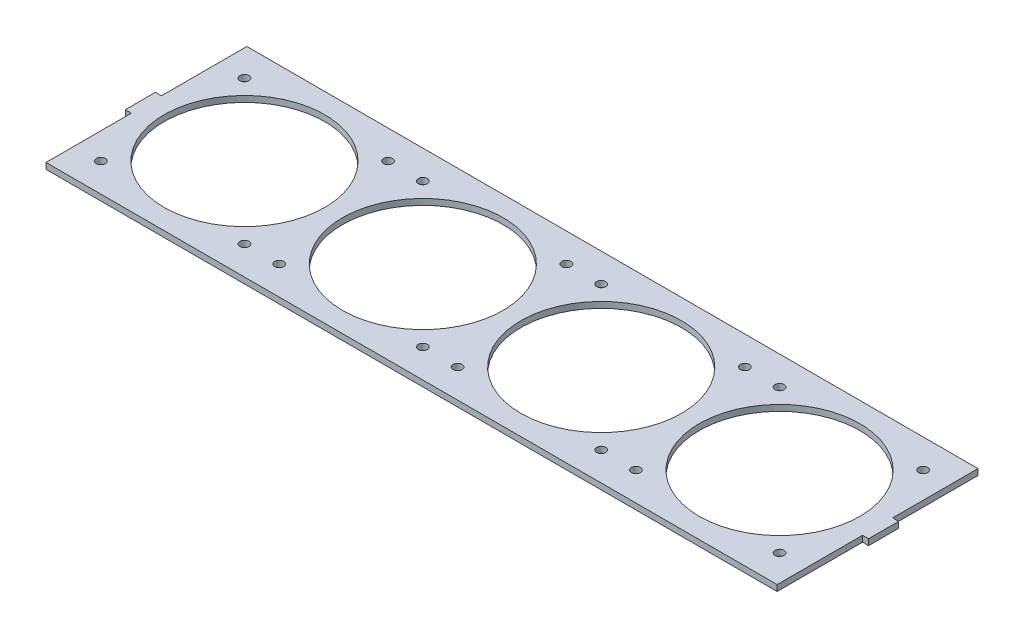
from build123d import *

# Parameters (mm, degrees)
SKETCH1_R           = 40
SKETCH1_R_2         = 2.25
BOSS_EXTRUDE1_DEPTH = 3


with BuildPart() as part:
    # Sketch1 → Boss-Extrude1 (new body)
    with BuildSketch(Plane(origin=(0, 0, 0), x_dir=(1, 0, 0), z_dir=(0, 1, 0))):
        Polygon((75.462130999, 64.93515636), (-288.537869001, 64.93515636), (-288.537869001, 22.43515636), (-291.537869001, 22.43515636), (-291.537869001, 7.43515636), (-288.537869001, 7.43515636), (-288.537869001, -35.06484364), (75.462130999, -35.06484364), (75.462130999, 7.43515636), (78.462130999, 7.43515636), (78.462130999, 22.43515636), (75.462130999, 22.43515636), align=None)
        with Locations(Location((-239.737869001, 14.93515636, 0), (0, 0, 270))):
            Circle(SKETCH1_R, mode=Mode.SUBTRACT)
        with Locations(Location((-203.987869001, 50.68515636, 0), (0, 0, 270))):
            Circle(SKETCH1_R_2, mode=Mode.SUBTRACT)
        with Locations(Location((-203.987869001, -20.81484364, 0), (0, 0, 90))):
            Circle(SKETCH1_R_2, mode=Mode.SUBTRACT)
        with Locations(Location((-275.487869001, -20.81484364, 0), (0, 0, 270))):
            Circle(SKETCH1_R_2, mode=Mode.SUBTRACT)
        with Locations(Location((-275.487869001, 50.68515636, 0), (0, 0, 90))):
            Circle(SKETCH1_R_2, mode=Mode.SUBTRACT)
        with Locations(Location((-186.687869001, 50.68515636, 0), (0, 0, 90))):
            Circle(SKETCH1_R_2, mode=Mode.SUBTRACT)
        with Locations(Location((-150.937869001, 14.93515636, 0), (0, 0, 270))):
            Circle(SKETCH1_R, mode=Mode.SUBTRACT)
        with Locations(Location((-115.187869001, 50.68515636, 0), (0, 0, 270))):
            Circle(SKETCH1_R_2, mode=Mode.SUBTRACT)
        with Locations(Location((-186.687869001, -20.81484364, 0), (0, 0, 270))):
            Circle(SKETCH1_R_2, mode=Mode.SUBTRACT)
        with Locations(Location((-115.187869001, -20.81484364, 0), (0, 0, 90))):
            Circle(SKETCH1_R_2, mode=Mode.SUBTRACT)
        with Locations(Location((-97.887869001, 50.68515636, 0), (0, 0, 90))):
            Circle(SKETCH1_R_2, mode=Mode.SUBTRACT)
        with Locations(Location((-62.137869001, 14.93515636, 0), (0, 0, 270))):
            Circle(SKETCH1_R, mode=Mode.SUBTRACT)
        with Locations(Location((-26.387869001, 50.68515636, 0), (0, 0, 270))):
            Circle(SKETCH1_R_2, mode=Mode.SUBTRACT)
        with Locations(Location((-97.887869001, -20.81484364, 0), (0, 0, 270))):
            Circle(SKETCH1_R_2, mode=Mode.SUBTRACT)
        with Locations(Location((-26.387869001, -20.81484364, 0), (0, 0, 90))):
            Circle(SKETCH1_R_2, mode=Mode.SUBTRACT)
        with Locations(Location((-9.087869001, 50.68515636, 0), (0, 0, 90))):
            Circle(SKETCH1_R_2, mode=Mode.SUBTRACT)
        with Locations(Location((26.662130999, 14.93515636, 0), (0, 0, 270))):
            Circle(SKETCH1_R, mode=Mode.SUBTRACT)
        with Locations(Location((62.412130999, 50.68515636, 0), (0, 0, 270))):
            Circle(SKETCH1_R_2, mode=Mode.SUBTRACT)
        with Locations(Location((-9.087869001, -20.81484364, 0), (0, 0, 270))):
            Circle(SKETCH1_R_2, mode=Mode.SUBTRACT)
        with Locations(Location((62.412130999, -20.81484364, 0), (0, 0, 90))):
            Circle(SKETCH1_R_2, mode=Mode.SUBTRACT)
    extrude(amount=BOSS_EXTRUDE1_DEPTH)


solid = part.part
